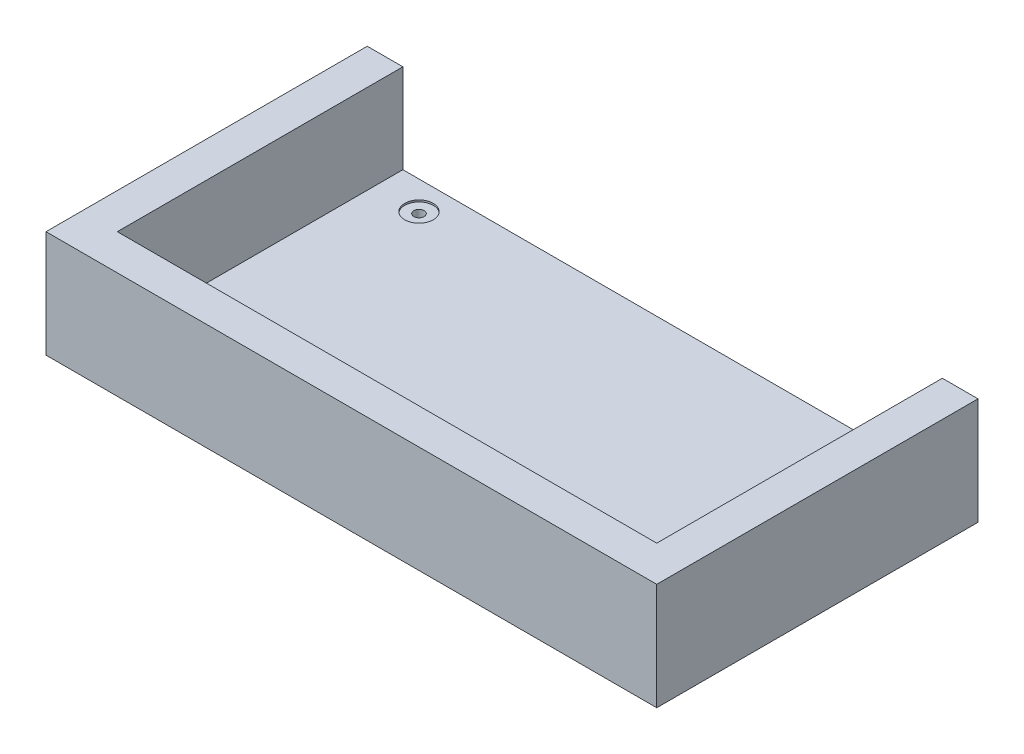
from build123d import *

# Parameters (mm, degrees)
SKETCH1_W                                            = 151.33
SKETCH1_H                                            = 80.12
BOSS_EXTRUDE1_DEPTH                                  = 5
SKETCH3_W                                            = 10
SKETCH3_H                                            = 90.12
SKETCH3_W_2                                          = 151.33
SKETCH3_H_2                                          = 10
BOSS_EXTRUDE2_DEPTH                                  = 30
CBORE_FOR_M2_5_HEXAGON_HEAD_BOLTS_FULL_T_D           = 2.9
CBORE_FOR_M2_5_HEXAGON_HEAD_BOLTS_FULL_T_DEPTH       = 20
CBORE_FOR_M2_5_HEXAGON_HEAD_BOLTS_FULL_T_CBORE_D     = 8
CBORE_FOR_M2_5_HEXAGON_HEAD_BOLTS_FULL_T_CBORE_DEPTH = 0.5
CBORE_FOR_M2_5_HEXAGON_HEAD_BOLTS_FULL_T_TIP         = 0.871247898


with BuildPart() as part:
    # Sketch1 → Boss-Extrude1 (new body)
    with BuildSketch(Plane(origin=(0, 0, 0), x_dir=(1, 0, 0), z_dir=(0, 1, 0))):
        with Locations((21.993286604, 13.310186916)):
            Rectangle(SKETCH1_W, SKETCH1_H)
    extrude(amount=BOSS_EXTRUDE1_DEPTH)

    # Sketch3 → Boss-Extrude2 (add)
    with BuildSketch(Plane(origin=(0, 0, 0), x_dir=(1, 0, 0), z_dir=(0, 1, 0))):
        with Locations((-58.671713396, 8.310186916)):
            Rectangle(SKETCH3_W, SKETCH3_H)
        with Locations((21.993286604, -31.749813084)):
            Rectangle(SKETCH3_W_2, SKETCH3_H_2)
        with Locations((102.658286604, 8.310186916)):
            Rectangle(SKETCH3_W, SKETCH3_H)
    extrude(amount=BOSS_EXTRUDE2_DEPTH)

    # CBORE for M2.5 Hexagon head bolts-Full thread-grades AB1
    with Locations(Plane(origin=(85.700408956, 5, 16.256611899), x_dir=(0, 0, 1), z_dir=(0, 1, 0))):
        with Locations((0, 0), (0.080180531, -126.947449906), (-61.719848362, -126.947449906), (-61.719848362, 0.369580631)):
            CounterBoreHole(CBORE_FOR_M2_5_HEXAGON_HEAD_BOLTS_FULL_T_D / 2, CBORE_FOR_M2_5_HEXAGON_HEAD_BOLTS_FULL_T_CBORE_D / 2, CBORE_FOR_M2_5_HEXAGON_HEAD_BOLTS_FULL_T_CBORE_DEPTH, depth=CBORE_FOR_M2_5_HEXAGON_HEAD_BOLTS_FULL_T_DEPTH)
            with Locations((0, 0, -(CBORE_FOR_M2_5_HEXAGON_HEAD_BOLTS_FULL_T_DEPTH + CBORE_FOR_M2_5_HEXAGON_HEAD_BOLTS_FULL_T_TIP / 2))):  # 118° drill point
                Cone(0, CBORE_FOR_M2_5_HEXAGON_HEAD_BOLTS_FULL_T_D / 2, CBORE_FOR_M2_5_HEXAGON_HEAD_BOLTS_FULL_T_TIP, mode=Mode.SUBTRACT)


solid = part.part
